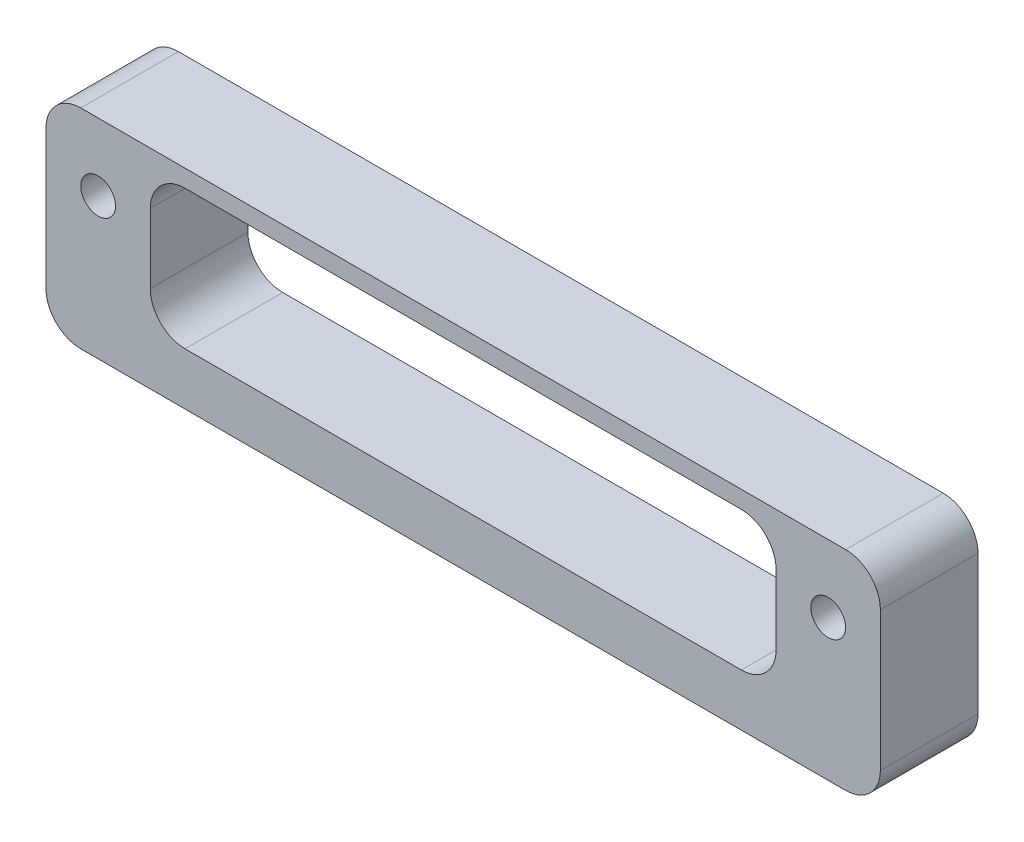
from build123d import *

# Parameters (mm, degrees)
SKETCH1_W           = 152.4
SKETCH1_H           = 38.1
BOSS_EXTRUDE1_DEPTH = 17.8308
SKETCH2_W           = 114.3
SKETCH2_H           = 25.4
CUT_EXTRUDE1_DEPTH  = 81.543652317
FILLET1_R           = 6.35
SKETCH3_R           = 3.175
CUT_EXTRUDE2_DEPTH  = 81.543652317


with BuildPart() as part:
    # Sketch1 → Boss-Extrude1 (new body)
    with BuildSketch(Plane.XY):
        Rectangle(SKETCH1_W, SKETCH1_H)
    extrude(amount=BOSS_EXTRUDE1_DEPTH)

    # Sketch2 → Cut-Extrude1 (cut, through all)
    with BuildSketch(Plane.XY.offset(17.8308)):
        with Locations((0, 3.175)):
            Rectangle(SKETCH2_W, SKETCH2_H)
    extrude(amount=-CUT_EXTRUDE1_DEPTH, mode=Mode.SUBTRACT)

    # Fillet1
    fillet1_edges = [part.edges().sort_by_distance(p)[0] for p in [
        (-57.15, -9.525, 8.9154),
        (-57.15, 15.875, 8.9154),
        (57.15, 15.875, 8.9154),
        (57.15, -9.525, 8.9154),
        (-76.2, 19.05, 8.9154),
        (76.2, 19.05, 8.9154),
        (76.2, -19.05, 8.9154),
        (-76.2, -19.05, 8.9154),
    ]]
    fillet(fillet1_edges, radius=FILLET1_R)

    # Sketch3 → Cut-Extrude2 (cut, through all)
    with BuildSketch(Plane.XY.offset(17.8308)):
        with Locations((-66.675, 6.71302)):
            Circle(SKETCH3_R)
        with Locations((66.675, 6.71302)):
            Circle(SKETCH3_R)
    extrude(amount=-CUT_EXTRUDE2_DEPTH, mode=Mode.SUBTRACT)


solid = part.part
